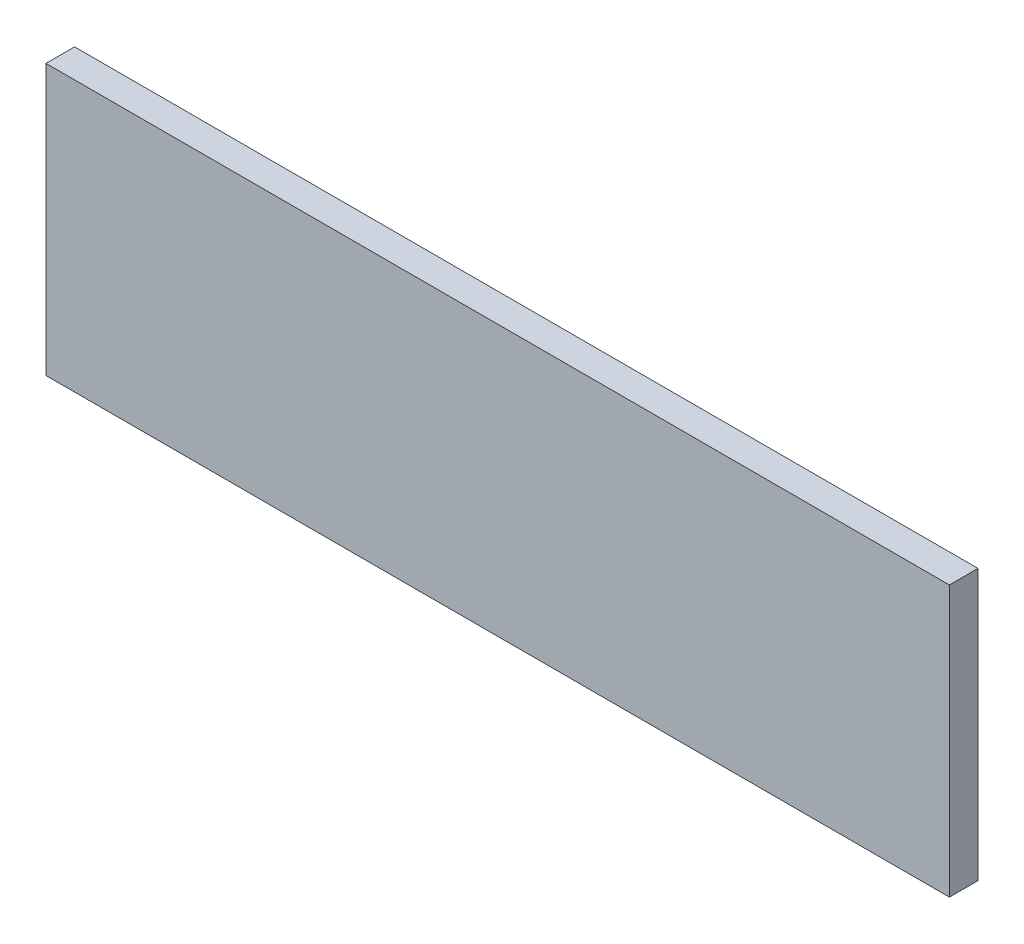
from build123d import *

# Parameters (mm, degrees)
SKETCH1_W           = 100.24
SKETCH1_H           = 30
BOSS_EXTRUDE1_DEPTH = 3.175


with BuildPart() as part:
    # Sketch1 → Boss-Extrude1 (new body)
    with BuildSketch(Plane.XY):
        Rectangle(SKETCH1_W, SKETCH1_H)
    extrude(amount=BOSS_EXTRUDE1_DEPTH)


solid = part.part
